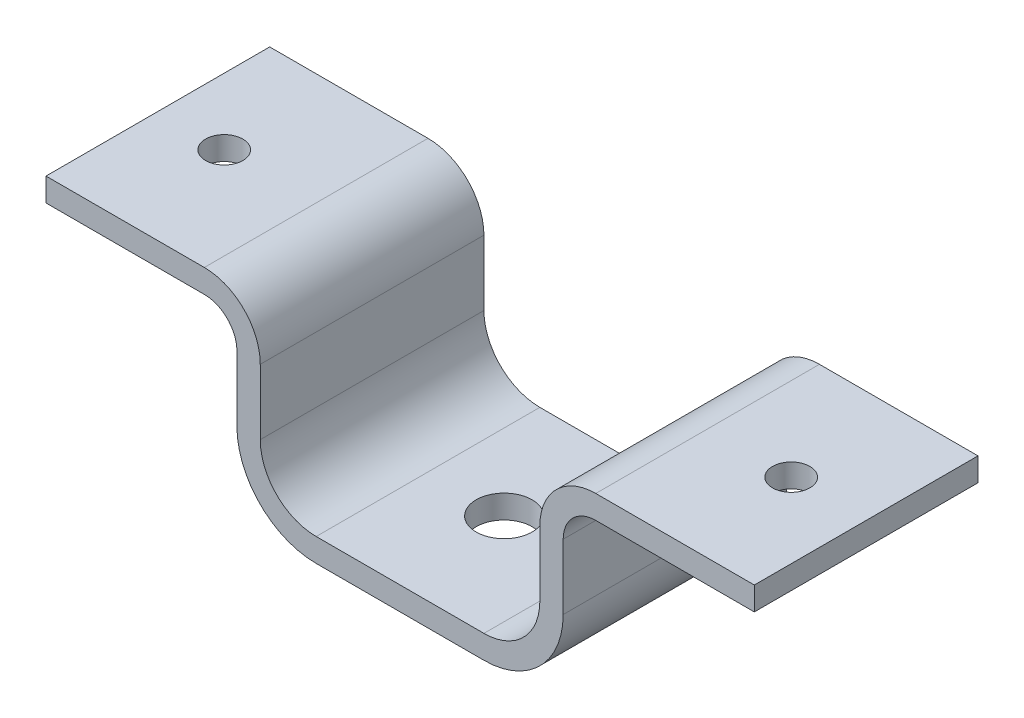
from build123d import *

# Parameters (mm, degrees)
BOSS_EXTRUDE1_DEPTH = 38.1
SKETCH4_R           = 9.525
SKETCH4_R_2         = 6.35
CUT_EXTRUDE1_DEPTH  = 76.2


with BuildPart() as part:
    # Sketch3 → Boss-Extrude1 (new, symmetric)
    with BuildSketch(Plane.XY):
        with BuildLine():
            Line((-308.473797305, 97.683602722), (-254.535984299, 97.683602722))
            ThreePointArc((-254.535984299, 97.683602722), (-241.065600117, 92.103986904), (-235.485984299, 78.633602722))
            Line((-235.485984299, 78.633602722), (-235.485984299, 56.408602722))
            ThreePointArc((-235.485984299, 56.408602722), (-229.90636848, 42.938218541), (-216.435984299, 37.358602722))
            Line((-216.435984299, 37.358602722), (-159.285984299, 37.358602722))
            ThreePointArc((-159.285984299, 37.358602722), (-145.815600117, 42.938218541), (-140.235984299, 56.408602722))
            Line((-140.235984299, 56.408602722), (-140.235984299, 78.633602722))
            ThreePointArc((-140.235984299, 78.633602722), (-134.65636848, 92.103986904), (-121.185984299, 97.683602722))
            Line((-121.185984299, 97.683602722), (-67.173797305, 97.683602722))
            Line((-67.173797305, 97.683602722), (-67.173797305, 89.733402722))
            Line((-67.173797305, 89.733402722), (-121.185984299, 89.733402722))
            ThreePointArc((-121.185984299, 89.733402722), (-129.034728149, 86.482346572), (-132.285784299, 78.633602722))
            Line((-132.285784299, 78.633602722), (-132.285784299, 56.408602722))
            ThreePointArc((-132.285784299, 56.408602722), (-140.193959785, 37.316578209), (-159.285984299, 29.408402722))
            Line((-159.285984299, 29.408402722), (-216.435984299, 29.408402722))
            ThreePointArc((-216.435984299, 29.408402722), (-235.528008812, 37.316578209), (-243.436184299, 56.408602722))
            Line((-243.436184299, 56.408602722), (-243.436184299, 78.633602722))
            ThreePointArc((-243.436184299, 78.633602722), (-246.687240449, 86.482346572), (-254.535984299, 89.733402722))
            Line((-254.535984299, 89.733402722), (-308.473797305, 89.733402722))
            Line((-308.473797305, 89.733402722), (-308.473797305, 97.683602722))
        make_face()
    extrude(amount=BOSS_EXTRUDE1_DEPTH, both=True)

    # Sketch4 → Cut-Extrude1 (cut)
    with BuildSketch(Plane(origin=(0, 97.683602722, 0), x_dir=(1, 0, 0), z_dir=(0, 1, 0))):
        with Locations(Location((-190.5, 0, 0), (0, 0, 180))):
            Circle(SKETCH4_R)
        with Locations(Location((-285.859715502, 0, 0), (0, 0, 270))):
            Circle(SKETCH4_R_2)
        with Locations(Location((-92.710517543, 0, 0), (0, 0, 270))):
            Circle(SKETCH4_R_2)
    extrude(amount=-CUT_EXTRUDE1_DEPTH, mode=Mode.SUBTRACT)


solid = part.part
